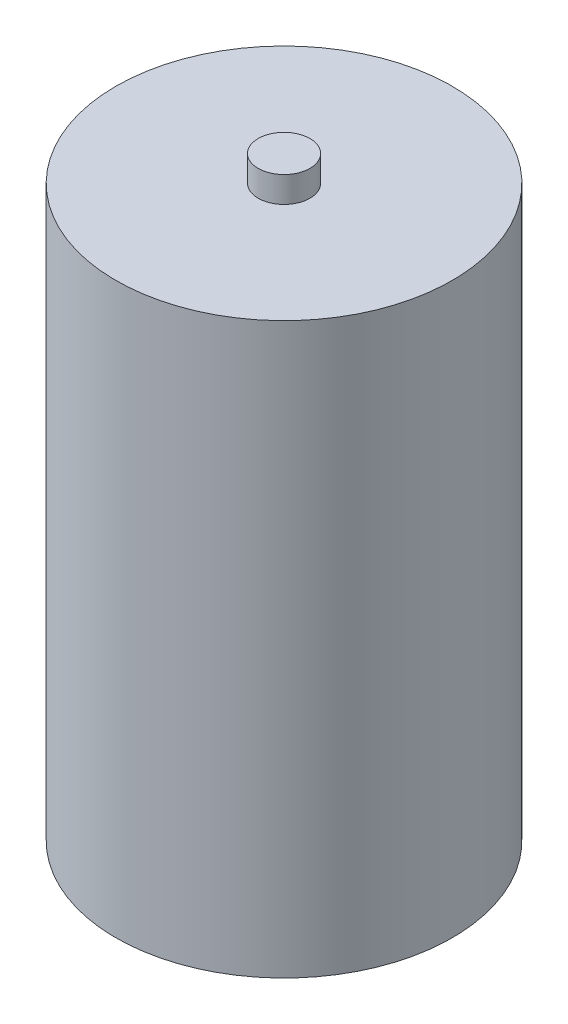
from build123d import *


with BuildPart() as part:
    # Croquis1 → Revolución1 (revolve)
    with BuildSketch(Plane.XY, mode=Mode.PRIVATE) as revoluci_n1_sk:
        Polygon((0, 120), (5, 120), (5, 115), (32.5, 115), (32.5, 5), (5, 5), (5, 0), (0, 0), align=None)
    revolve(revoluci_n1_sk.sketch.rotate(Axis((0, 120, 0), (0, -1, 0)), 180), axis=Axis((0, 120, 0), (0, -1, 0)))


solid = part.part
